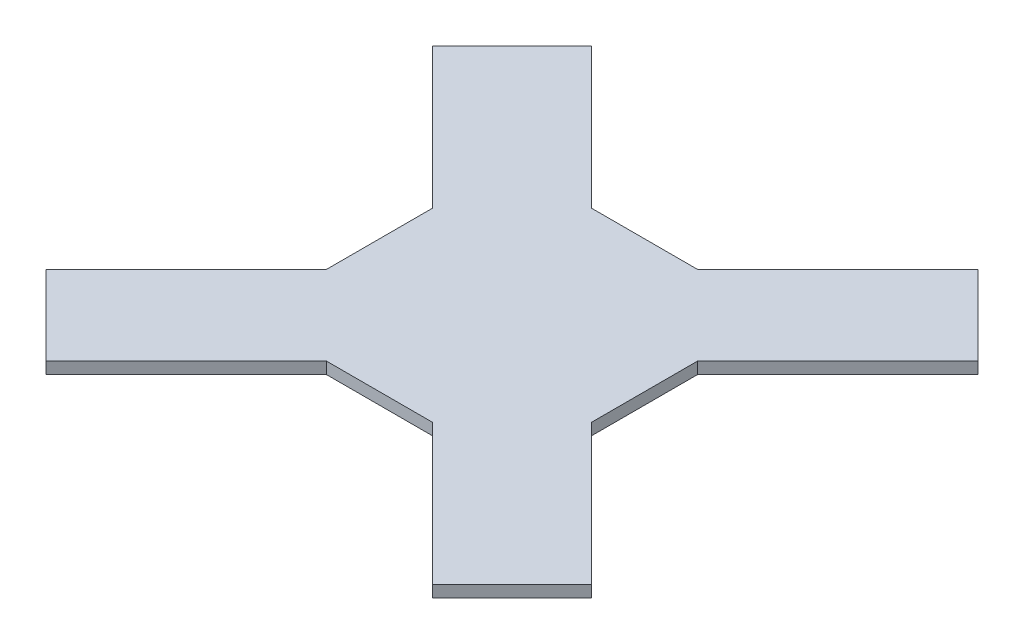
from build123d import *

# Parameters (mm, degrees)
BOSS_EXTRUDE1_DEPTH = 10


with BuildPart() as part:
    # Sketch1 → Boss-Extrude1 (new body)
    with BuildSketch(Plane(origin=(0, 0, 0), x_dir=(1, 0, 0), z_dir=(0, 1, 0))):
        Polygon((-112.798741958, 44.916490964), (-112.798741958, -45.41089014), (-232.530110784, -165.142258966), (-164.64785979, -233.02450996), (-44.916490964, -113.293141134), (45.41089014, -113.293141134), (165.142258966, -233.02450996), (233.02450996, -165.142258966), (113.293141134, -45.41089014), (113.293141134, 44.916490964), (233.02450996, 164.64785979), (165.142258966, 232.530110784), (45.41089014, 112.798741958), (-44.916490964, 112.798741958), (-164.64785979, 232.530110784), (-232.530110784, 164.64785979), align=None)
    extrude(amount=BOSS_EXTRUDE1_DEPTH)


solid = part.part
